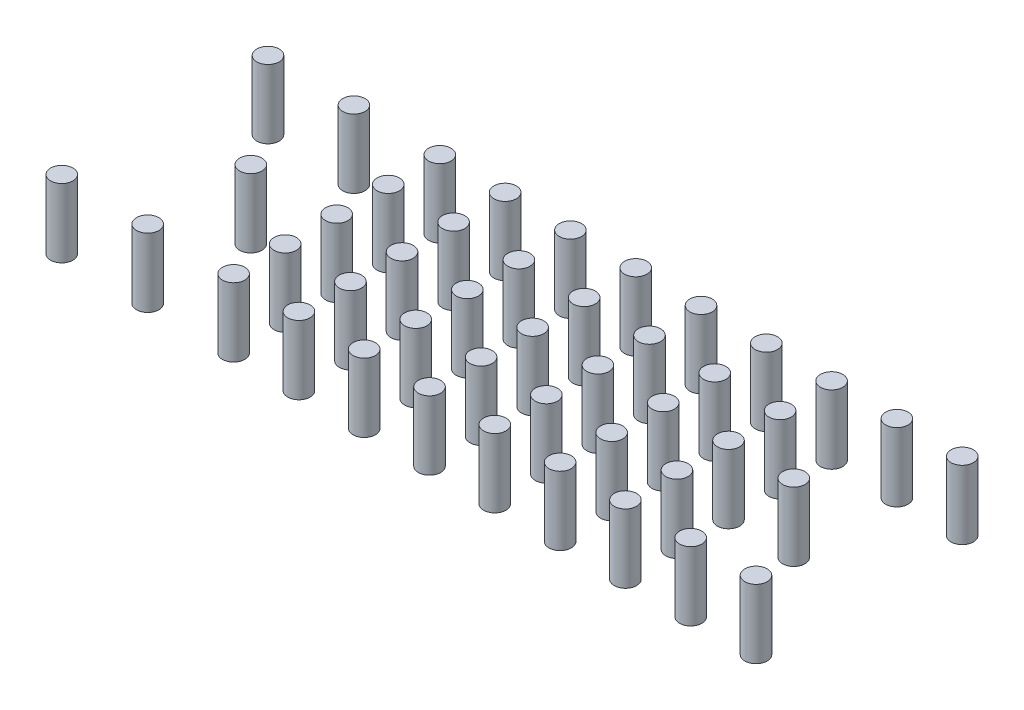
from build123d import *

# Parameters (mm, degrees)
SKETCH2_R              = 0.325
BOSS_EXTRUDE1_DEPTH    = 2
BOSS_EXTRUDE1_2_DEPTH  = 2
BOSS_EXTRUDE1_3_DEPTH  = 2
BOSS_EXTRUDE1_4_DEPTH  = 2
BOSS_EXTRUDE1_5_DEPTH  = 2
BOSS_EXTRUDE1_6_DEPTH  = 2
BOSS_EXTRUDE1_7_DEPTH  = 2
BOSS_EXTRUDE1_8_DEPTH  = 2
BOSS_EXTRUDE1_9_DEPTH  = 2
BOSS_EXTRUDE1_10_DEPTH = 2
BOSS_EXTRUDE1_11_DEPTH = 2
BOSS_EXTRUDE1_12_DEPTH = 2
BOSS_EXTRUDE1_13_DEPTH = 2
BOSS_EXTRUDE1_14_DEPTH = 2
BOSS_EXTRUDE1_15_DEPTH = 2
BOSS_EXTRUDE1_16_DEPTH = 2
BOSS_EXTRUDE1_17_DEPTH = 2
BOSS_EXTRUDE1_18_DEPTH = 2
BOSS_EXTRUDE1_19_DEPTH = 2
BOSS_EXTRUDE1_20_DEPTH = 2
BOSS_EXTRUDE1_21_DEPTH = 2
BOSS_EXTRUDE1_22_DEPTH = 2
BOSS_EXTRUDE1_23_DEPTH = 2
BOSS_EXTRUDE1_24_DEPTH = 2
BOSS_EXTRUDE1_25_DEPTH = 2
BOSS_EXTRUDE1_26_DEPTH = 2
BOSS_EXTRUDE1_27_DEPTH = 2
BOSS_EXTRUDE1_28_DEPTH = 2
BOSS_EXTRUDE1_29_DEPTH = 2
BOSS_EXTRUDE1_30_DEPTH = 2
BOSS_EXTRUDE1_31_DEPTH = 2
BOSS_EXTRUDE1_32_DEPTH = 2
BOSS_EXTRUDE1_33_DEPTH = 2
BOSS_EXTRUDE1_34_DEPTH = 2
BOSS_EXTRUDE1_35_DEPTH = 2
BOSS_EXTRUDE1_36_DEPTH = 2
BOSS_EXTRUDE1_37_DEPTH = 2
BOSS_EXTRUDE1_38_DEPTH = 2
BOSS_EXTRUDE1_39_DEPTH = 2
BOSS_EXTRUDE1_40_DEPTH = 2
BOSS_EXTRUDE1_41_DEPTH = 2
BOSS_EXTRUDE1_42_DEPTH = 2
BOSS_EXTRUDE1_43_DEPTH = 2
BOSS_EXTRUDE1_44_DEPTH = 2
BOSS_EXTRUDE1_45_DEPTH = 2


with BuildPart() as part:
    # Sketch2 → Boss-Extrude1 (new body)
    with BuildSketch(Plane(origin=(0, 0, 0), x_dir=(1, 0, 0), z_dir=(0, 1, 0))):
        with Locations(Location((0.725, -0.625, 0), (0, 0, 270))):
            Circle(SKETCH2_R)
    extrude(amount=BOSS_EXTRUDE1_DEPTH)


with BuildPart() as body_2:
    # Sketch2 → Boss-Extrude1 2 (new body)
    with BuildSketch(Plane(origin=(0, 0, 0), x_dir=(1, 0, 0), z_dir=(0, 1, 0))):
        with Locations(Location((2.625, -0.625, 0), (0, 0, 270))):
            Circle(SKETCH2_R)
    extrude(amount=BOSS_EXTRUDE1_2_DEPTH)


with BuildPart() as body_3:
    # Sketch2 → Boss-Extrude1 3 (new body)
    with BuildSketch(Plane(origin=(0, 0, 0), x_dir=(1, 0, 0), z_dir=(0, 1, 0))):
        with Locations(Location((4.525, -0.625, 0), (0, 0, 270))):
            Circle(SKETCH2_R)
    extrude(amount=BOSS_EXTRUDE1_3_DEPTH)


with BuildPart() as body_4:
    # Sketch2 → Boss-Extrude1 4 (new body)
    with BuildSketch(Plane(origin=(0, 0, 0), x_dir=(1, 0, 0), z_dir=(0, 1, 0))):
        with Locations(Location((6.425, -0.625, 0), (0, 0, 270))):
            Circle(SKETCH2_R)
    extrude(amount=BOSS_EXTRUDE1_4_DEPTH)


with BuildPart() as body_5:
    # Sketch2 → Boss-Extrude1 5 (new body)
    with BuildSketch(Plane(origin=(0, 0, 0), x_dir=(1, 0, 0), z_dir=(0, 1, 0))):
        with Locations(Location((8.325, -0.625, 0), (0, 0, 270))):
            Circle(SKETCH2_R)
    extrude(amount=BOSS_EXTRUDE1_5_DEPTH)


with BuildPart() as body_6:
    # Sketch2 → Boss-Extrude1 6 (new body)
    with BuildSketch(Plane(origin=(0, 0, 0), x_dir=(1, 0, 0), z_dir=(0, 1, 0))):
        with Locations(Location((10.225, -0.625, 0), (0, 0, 270))):
            Circle(SKETCH2_R)
    extrude(amount=BOSS_EXTRUDE1_6_DEPTH)


with BuildPart() as body_7:
    # Sketch2 → Boss-Extrude1 7 (new body)
    with BuildSketch(Plane(origin=(0, 0, 0), x_dir=(1, 0, 0), z_dir=(0, 1, 0))):
        with Locations(Location((12.125, -0.625, 0), (0, 0, 270))):
            Circle(SKETCH2_R)
    extrude(amount=BOSS_EXTRUDE1_7_DEPTH)


with BuildPart() as body_8:
    # Sketch2 → Boss-Extrude1 8 (new body)
    with BuildSketch(Plane(origin=(0, 0, 0), x_dir=(1, 0, 0), z_dir=(0, 1, 0))):
        with Locations(Location((14.025, -0.625, 0), (0, 0, 270))):
            Circle(SKETCH2_R)
    extrude(amount=BOSS_EXTRUDE1_8_DEPTH)


with BuildPart() as body_9:
    # Sketch2 → Boss-Extrude1 9 (new body)
    with BuildSketch(Plane(origin=(0, 0, 0), x_dir=(1, 0, 0), z_dir=(0, 1, 0))):
        with Locations(Location((15.925, -0.625, 0), (0, 0, 270))):
            Circle(SKETCH2_R)
    extrude(amount=BOSS_EXTRUDE1_9_DEPTH)


with BuildPart() as body_10:
    # Sketch2 → Boss-Extrude1 10 (new body)
    with BuildSketch(Plane(origin=(0, 0, 0), x_dir=(1, 0, 0), z_dir=(0, 1, 0))):
        with Locations(Location((2.625, 0.875, 0), (0, 0, 270))):
            Circle(SKETCH2_R)
    extrude(amount=BOSS_EXTRUDE1_10_DEPTH)


with BuildPart() as body_11:
    # Sketch2 → Boss-Extrude1 11 (new body)
    with BuildSketch(Plane(origin=(0, 0, 0), x_dir=(1, 0, 0), z_dir=(0, 1, 0))):
        with Locations(Location((4.525, 0.875, 0), (0, 0, 270))):
            Circle(SKETCH2_R)
    extrude(amount=BOSS_EXTRUDE1_11_DEPTH)


with BuildPart() as body_12:
    # Sketch2 → Boss-Extrude1 12 (new body)
    with BuildSketch(Plane(origin=(0, 0, 0), x_dir=(1, 0, 0), z_dir=(0, 1, 0))):
        with Locations(Location((6.425, 0.875, 0), (0, 0, 270))):
            Circle(SKETCH2_R)
    extrude(amount=BOSS_EXTRUDE1_12_DEPTH)


with BuildPart() as body_13:
    # Sketch2 → Boss-Extrude1 13 (new body)
    with BuildSketch(Plane(origin=(0, 0, 0), x_dir=(1, 0, 0), z_dir=(0, 1, 0))):
        with Locations(Location((8.325, 0.875, 0), (0, 0, 270))):
            Circle(SKETCH2_R)
    extrude(amount=BOSS_EXTRUDE1_13_DEPTH)


with BuildPart() as body_14:
    # Sketch2 → Boss-Extrude1 14 (new body)
    with BuildSketch(Plane(origin=(0, 0, 0), x_dir=(1, 0, 0), z_dir=(0, 1, 0))):
        with Locations(Location((10.225, 0.875, 0), (0, 0, 270))):
            Circle(SKETCH2_R)
    extrude(amount=BOSS_EXTRUDE1_14_DEPTH)


with BuildPart() as body_15:
    # Sketch2 → Boss-Extrude1 15 (new body)
    with BuildSketch(Plane(origin=(0, 0, 0), x_dir=(1, 0, 0), z_dir=(0, 1, 0))):
        with Locations(Location((12.125, 0.875, 0), (0, 0, 270))):
            Circle(SKETCH2_R)
    extrude(amount=BOSS_EXTRUDE1_15_DEPTH)


with BuildPart() as body_16:
    # Sketch2 → Boss-Extrude1 16 (new body)
    with BuildSketch(Plane(origin=(0, 0, 0), x_dir=(1, 0, 0), z_dir=(0, 1, 0))):
        with Locations(Location((2.625, 2.375, 0), (0, 0, 270))):
            Circle(SKETCH2_R)
    extrude(amount=BOSS_EXTRUDE1_16_DEPTH)


with BuildPart() as body_17:
    # Sketch2 → Boss-Extrude1 17 (new body)
    with BuildSketch(Plane(origin=(0, 0, 0), x_dir=(1, 0, 0), z_dir=(0, 1, 0))):
        with Locations(Location((4.525, 2.375, 0), (0, 0, 270))):
            Circle(SKETCH2_R)
    extrude(amount=BOSS_EXTRUDE1_17_DEPTH)


with BuildPart() as body_18:
    # Sketch2 → Boss-Extrude1 18 (new body)
    with BuildSketch(Plane(origin=(0, 0, 0), x_dir=(1, 0, 0), z_dir=(0, 1, 0))):
        with Locations(Location((6.425, 2.375, 0), (0, 0, 270))):
            Circle(SKETCH2_R)
    extrude(amount=BOSS_EXTRUDE1_18_DEPTH)


with BuildPart() as body_19:
    # Sketch2 → Boss-Extrude1 19 (new body)
    with BuildSketch(Plane(origin=(0, 0, 0), x_dir=(1, 0, 0), z_dir=(0, 1, 0))):
        with Locations(Location((8.325, 2.375, 0), (0, 0, 270))):
            Circle(SKETCH2_R)
    extrude(amount=BOSS_EXTRUDE1_19_DEPTH)


with BuildPart() as body_20:
    # Sketch2 → Boss-Extrude1 20 (new body)
    with BuildSketch(Plane(origin=(0, 0, 0), x_dir=(1, 0, 0), z_dir=(0, 1, 0))):
        with Locations(Location((10.225, 2.375, 0), (0, 0, 270))):
            Circle(SKETCH2_R)
    extrude(amount=BOSS_EXTRUDE1_20_DEPTH)


with BuildPart() as body_21:
    # Sketch2 → Boss-Extrude1 21 (new body)
    with BuildSketch(Plane(origin=(0, 0, 0), x_dir=(1, 0, 0), z_dir=(0, 1, 0))):
        with Locations(Location((12.125, 2.375, 0), (0, 0, 270))):
            Circle(SKETCH2_R)
    extrude(amount=BOSS_EXTRUDE1_21_DEPTH)


with BuildPart() as body_22:
    # Sketch2 → Boss-Extrude1 22 (new body)
    with BuildSketch(Plane(origin=(0, 0, 0), x_dir=(1, 0, 0), z_dir=(0, 1, 0))):
        with Locations(Location((14.025, 2.375, 0), (0, 0, 270))):
            Circle(SKETCH2_R)
    extrude(amount=BOSS_EXTRUDE1_22_DEPTH)


with BuildPart() as body_23:
    # Sketch2 → Boss-Extrude1 23 (new body)
    with BuildSketch(Plane(origin=(0, 0, 0), x_dir=(1, 0, 0), z_dir=(0, 1, 0))):
        with Locations(Location((2.625, 3.875, 0), (0, 0, 270))):
            Circle(SKETCH2_R)
    extrude(amount=BOSS_EXTRUDE1_23_DEPTH)


with BuildPart() as body_24:
    # Sketch2 → Boss-Extrude1 24 (new body)
    with BuildSketch(Plane(origin=(0, 0, 0), x_dir=(1, 0, 0), z_dir=(0, 1, 0))):
        with Locations(Location((4.525, 3.875, 0), (0, 0, 270))):
            Circle(SKETCH2_R)
    extrude(amount=BOSS_EXTRUDE1_24_DEPTH)


with BuildPart() as body_25:
    # Sketch2 → Boss-Extrude1 25 (new body)
    with BuildSketch(Plane(origin=(0, 0, 0), x_dir=(1, 0, 0), z_dir=(0, 1, 0))):
        with Locations(Location((6.425, 3.875, 0), (0, 0, 270))):
            Circle(SKETCH2_R)
    extrude(amount=BOSS_EXTRUDE1_25_DEPTH)


with BuildPart() as body_26:
    # Sketch2 → Boss-Extrude1 26 (new body)
    with BuildSketch(Plane(origin=(0, 0, 0), x_dir=(1, 0, 0), z_dir=(0, 1, 0))):
        with Locations(Location((8.325, 3.875, 0), (0, 0, 270))):
            Circle(SKETCH2_R)
    extrude(amount=BOSS_EXTRUDE1_26_DEPTH)


with BuildPart() as body_27:
    # Sketch2 → Boss-Extrude1 27 (new body)
    with BuildSketch(Plane(origin=(0, 0, 0), x_dir=(1, 0, 0), z_dir=(0, 1, 0))):
        with Locations(Location((10.225, 3.875, 0), (0, 0, 270))):
            Circle(SKETCH2_R)
    extrude(amount=BOSS_EXTRUDE1_27_DEPTH)


with BuildPart() as body_28:
    # Sketch2 → Boss-Extrude1 28 (new body)
    with BuildSketch(Plane(origin=(0, 0, 0), x_dir=(1, 0, 0), z_dir=(0, 1, 0))):
        with Locations(Location((12.125, 3.875, 0), (0, 0, 270))):
            Circle(SKETCH2_R)
    extrude(amount=BOSS_EXTRUDE1_28_DEPTH)


with BuildPart() as body_29:
    # Sketch2 → Boss-Extrude1 29 (new body)
    with BuildSketch(Plane(origin=(0, 0, 0), x_dir=(1, 0, 0), z_dir=(0, 1, 0))):
        with Locations(Location((2.625, 5.375, 0), (0, 0, 270))):
            Circle(SKETCH2_R)
    extrude(amount=BOSS_EXTRUDE1_29_DEPTH)


with BuildPart() as body_30:
    # Sketch2 → Boss-Extrude1 30 (new body)
    with BuildSketch(Plane(origin=(0, 0, 0), x_dir=(1, 0, 0), z_dir=(0, 1, 0))):
        with Locations(Location((4.525, 5.375, 0), (0, 0, 270))):
            Circle(SKETCH2_R)
    extrude(amount=BOSS_EXTRUDE1_30_DEPTH)


with BuildPart() as body_31:
    # Sketch2 → Boss-Extrude1 31 (new body)
    with BuildSketch(Plane(origin=(0, 0, 0), x_dir=(1, 0, 0), z_dir=(0, 1, 0))):
        with Locations(Location((6.425, 5.375, 0), (0, 0, 270))):
            Circle(SKETCH2_R)
    extrude(amount=BOSS_EXTRUDE1_31_DEPTH)


with BuildPart() as body_32:
    # Sketch2 → Boss-Extrude1 32 (new body)
    with BuildSketch(Plane(origin=(0, 0, 0), x_dir=(1, 0, 0), z_dir=(0, 1, 0))):
        with Locations(Location((8.325, 5.375, 0), (0, 0, 270))):
            Circle(SKETCH2_R)
    extrude(amount=BOSS_EXTRUDE1_32_DEPTH)


with BuildPart() as body_33:
    # Sketch2 → Boss-Extrude1 33 (new body)
    with BuildSketch(Plane(origin=(0, 0, 0), x_dir=(1, 0, 0), z_dir=(0, 1, 0))):
        with Locations(Location((10.225, 5.375, 0), (0, 0, 270))):
            Circle(SKETCH2_R)
    extrude(amount=BOSS_EXTRUDE1_33_DEPTH)


with BuildPart() as body_34:
    # Sketch2 → Boss-Extrude1 34 (new body)
    with BuildSketch(Plane(origin=(0, 0, 0), x_dir=(1, 0, 0), z_dir=(0, 1, 0))):
        with Locations(Location((12.125, 5.375, 0), (0, 0, 270))):
            Circle(SKETCH2_R)
    extrude(amount=BOSS_EXTRUDE1_34_DEPTH)


with BuildPart() as body_35:
    # Sketch2 → Boss-Extrude1 35 (new body)
    with BuildSketch(Plane(origin=(0, 0, 0), x_dir=(1, 0, 0), z_dir=(0, 1, 0))):
        with Locations(Location((14.025, 5.375, 0), (0, 0, 270))):
            Circle(SKETCH2_R)
    extrude(amount=BOSS_EXTRUDE1_35_DEPTH)


with BuildPart() as body_36:
    # Sketch2 → Boss-Extrude1 36 (new body)
    with BuildSketch(Plane(origin=(0, 0, 0), x_dir=(1, 0, 0), z_dir=(0, 1, 0))):
        with Locations(Location((15.925, 5.375, 0), (0, 0, 270))):
            Circle(SKETCH2_R)
    extrude(amount=BOSS_EXTRUDE1_36_DEPTH)


with BuildPart() as body_37:
    # Sketch2 → Boss-Extrude1 37 (new body)
    with BuildSketch(Plane(origin=(0, 0, 0), x_dir=(1, 0, 0), z_dir=(0, 1, 0))):
        with Locations(Location((0.725, 0.875, 0), (0, 0, 270))):
            Circle(SKETCH2_R)
    extrude(amount=BOSS_EXTRUDE1_37_DEPTH)


with BuildPart() as body_38:
    # Sketch2 → Boss-Extrude1 38 (new body)
    with BuildSketch(Plane(origin=(0, 0, 0), x_dir=(1, 0, 0), z_dir=(0, 1, 0))):
        with Locations(Location((0.725, 2.375, 0), (0, 0, 270))):
            Circle(SKETCH2_R)
    extrude(amount=BOSS_EXTRUDE1_38_DEPTH)


with BuildPart() as body_39:
    # Sketch2 → Boss-Extrude1 39 (new body)
    with BuildSketch(Plane(origin=(0, 0, 0), x_dir=(1, 0, 0), z_dir=(0, 1, 0))):
        with Locations(Location((0.725, 3.875, 0), (0, 0, 270))):
            Circle(SKETCH2_R)
    extrude(amount=BOSS_EXTRUDE1_39_DEPTH)


with BuildPart() as body_40:
    # Sketch2 → Boss-Extrude1 40 (new body)
    with BuildSketch(Plane(origin=(0, 0, 0), x_dir=(1, 0, 0), z_dir=(0, 1, 0))):
        with Locations(Location((0.725, 5.375, 0), (0, 0, 270))):
            Circle(SKETCH2_R)
    extrude(amount=BOSS_EXTRUDE1_40_DEPTH)


with BuildPart() as body_41:
    # Sketch2 → Boss-Extrude1 41 (new body)
    with BuildSketch(Plane(origin=(0, 0, 0), x_dir=(1, 0, 0), z_dir=(0, 1, 0))):
        with Locations(Location((-1.775, -0.625, 0), (0, 0, 270))):
            Circle(SKETCH2_R)
    extrude(amount=BOSS_EXTRUDE1_41_DEPTH)


with BuildPart() as body_42:
    # Sketch2 → Boss-Extrude1 42 (new body)
    with BuildSketch(Plane(origin=(0, 0, 0), x_dir=(1, 0, 0), z_dir=(0, 1, 0))):
        with Locations(Location((-4.275, -0.625, 0), (0, 0, 270))):
            Circle(SKETCH2_R)
    extrude(amount=BOSS_EXTRUDE1_42_DEPTH)


with BuildPart() as body_43:
    # Sketch2 → Boss-Extrude1 43 (new body)
    with BuildSketch(Plane(origin=(0, 0, 0), x_dir=(1, 0, 0), z_dir=(0, 1, 0))):
        with Locations(Location((-4.275, 5.375, 0), (0, 0, 270))):
            Circle(SKETCH2_R)
    extrude(amount=BOSS_EXTRUDE1_43_DEPTH)


with BuildPart() as body_44:
    # Sketch2 → Boss-Extrude1 44 (new body)
    with BuildSketch(Plane(origin=(0, 0, 0), x_dir=(1, 0, 0), z_dir=(0, 1, 0))):
        with Locations(Location((-1.775, 2.375, 0), (0, 0, 270))):
            Circle(SKETCH2_R)
    extrude(amount=BOSS_EXTRUDE1_44_DEPTH)


with BuildPart() as body_45:
    # Sketch2 → Boss-Extrude1 45 (new body)
    with BuildSketch(Plane(origin=(0, 0, 0), x_dir=(1, 0, 0), z_dir=(0, 1, 0))):
        with Locations(Location((-1.775, 5.375, 0), (0, 0, 270))):
            Circle(SKETCH2_R)
    extrude(amount=BOSS_EXTRUDE1_45_DEPTH)


solid = Compound([part.part, body_2.part, body_3.part, body_4.part, body_5.part, body_6.part, body_7.part, body_8.part, body_9.part, body_10.part, body_11.part, body_12.part, body_13.part, body_14.part, body_15.part, body_16.part, body_17.part, body_18.part, body_19.part, body_20.part, body_21.part, body_22.part, body_23.part, body_24.part, body_25.part, body_26.part, body_27.part, body_28.part, body_29.part, body_30.part, body_31.part, body_32.part, body_33.part, body_34.part, body_35.part, body_36.part, body_37.part, body_38.part, body_39.part, body_40.part, body_41.part, body_42.part, body_43.part, body_44.part, body_45.part])
